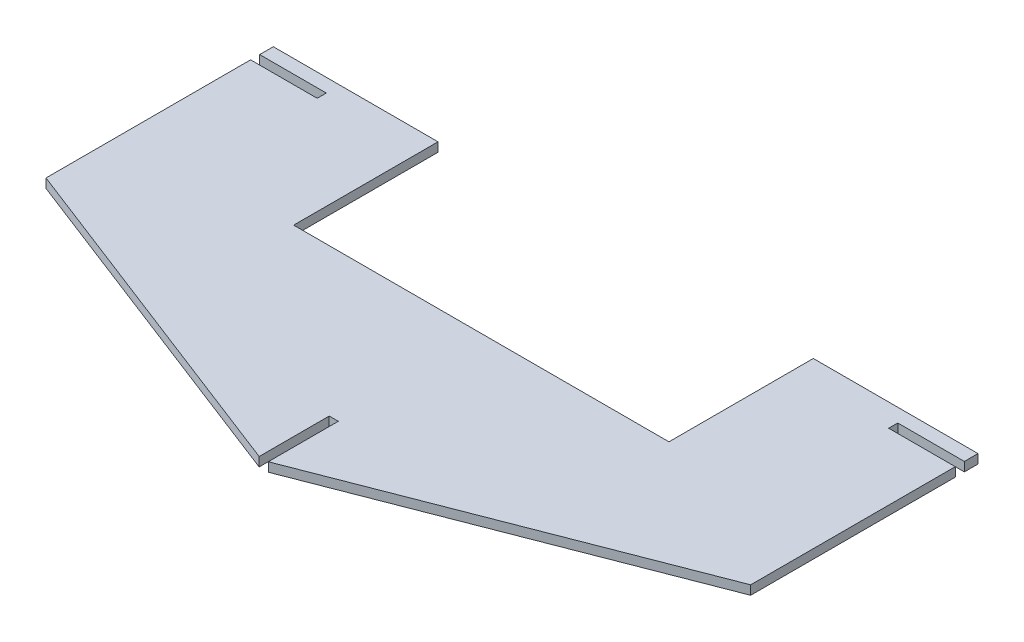
from build123d import *

# Parameters (mm, degrees)
BOSS_EXTRUDE1_DEPTH = 4
SKETCH2_W           = 165.1
SKETCH2_H           = 63.5
CUT_EXTRUDE1_DEPTH  = 349.523826216


with BuildPart() as part:
    # Sketch1 → Boss-Extrude1 (new body)
    with BuildSketch(Plane(origin=(0, 0, 0), x_dir=(1, 0, 0), z_dir=(0, 1, 0))):
        Polygon((310, -100), (310, -10), (280.7, -10), (280.7, -6), (310, -6), (310, 0), (0, 0), (0, -6), (29.3, -6), (29.3, -10), (0, -10), (0, -100), (153, -159.225806452), (153, -128.4), (157, -128.4), (157, -159.225806452), align=None)
    extrude(amount=BOSS_EXTRUDE1_DEPTH)

    # Sketch2 → Cut-Extrude1 (cut, through all)
    with BuildSketch(Plane(origin=(0, 4, 0), x_dir=(1, 0, 0), z_dir=(0, 1, 0))):
        with Locations((155, -31.75)):
            Rectangle(SKETCH2_W, SKETCH2_H)
    extrude(amount=-CUT_EXTRUDE1_DEPTH, mode=Mode.SUBTRACT)


solid = part.part
